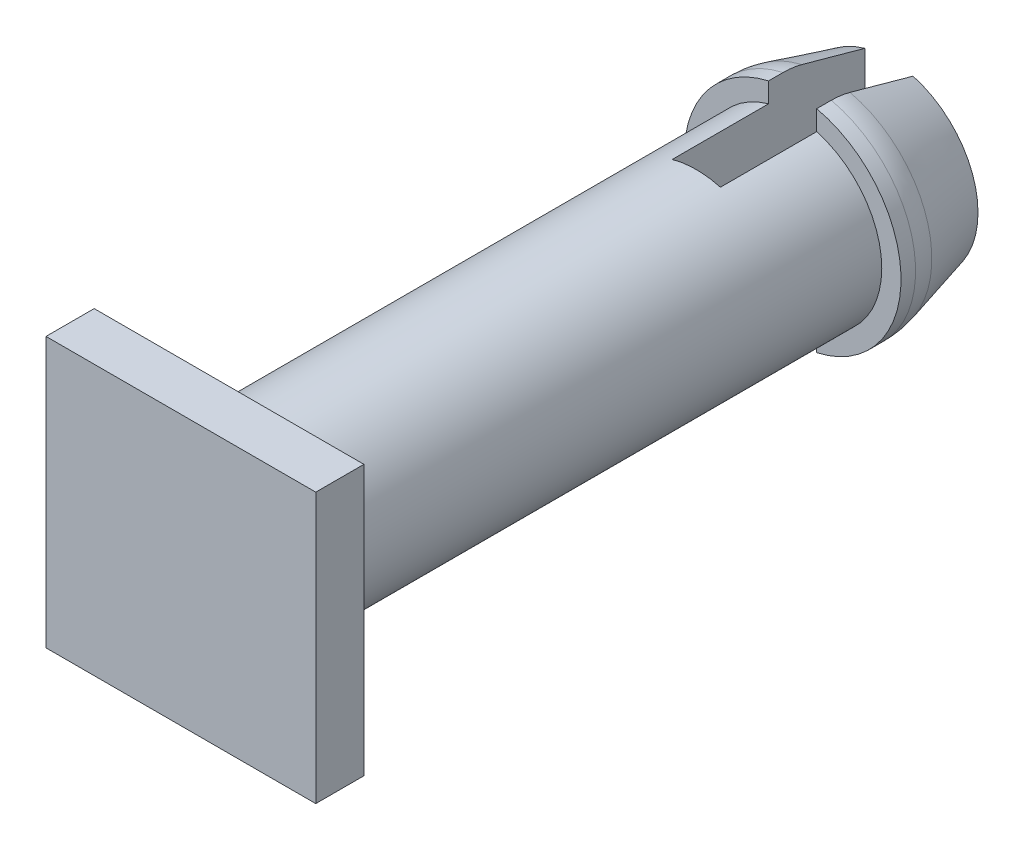
from build123d import *

# Parameters (mm, degrees)
SKETCH1_W           = 5.6
SKETCH1_H           = 5.6
BOSS_EXTRUDE1_DEPTH = 1
SKETCH1_3_R         = 1.85
BOSS_EXTRUDE2_DEPTH = 11.7
SKETCH2_R           = 0.6
CUT_EXTRUDE1_DEPTH  = 5
BOSS_EXTRUDE3_START = 2
SKETCH3_R           = 2.25
SKETCH3_R_2         = 0.6
BOSS_EXTRUDE3_DEPTH = 2
CHAMFER1_SIZE       = 1.5
CHAMFER1_SIZE2      = 0.401923789
SKETCH4_W           = 1
SKETCH4_H           = 5.286883196
CUT_EXTRUDE3_DEPTH  = 4
FILLET1_R           = 1.5


with BuildPart() as part:
    # Sketch1 → Boss-Extrude1 (new body)
    with BuildSketch(Plane.XY):
        Rectangle(SKETCH1_W, SKETCH1_H)
    extrude(amount=BOSS_EXTRUDE1_DEPTH)

    # Sketch1<3> → Boss-Extrude2 (add)
    with BuildSketch(Plane.XY):
        Circle(SKETCH1_3_R)
    extrude(amount=-BOSS_EXTRUDE2_DEPTH)

    # Sketch2 → Cut-Extrude1 (cut)
    with BuildSketch(Plane(origin=(0, 0, -11.7), x_dir=(-1, 0, 0), z_dir=(0, 0, -1))):
        Circle(SKETCH2_R)
    extrude(amount=-CUT_EXTRUDE1_DEPTH, mode=Mode.SUBTRACT)

    # Sketch3 → Boss-Extrude3 (add)
    with BuildSketch(Plane(origin=(0, 0, -11.7), x_dir=(-1, 0, 0), z_dir=(0, 0, -1)).offset(BOSS_EXTRUDE3_START)):
        Circle(SKETCH3_R)
        Circle(SKETCH3_R_2, mode=Mode.SUBTRACT)
    extrude(amount=-BOSS_EXTRUDE3_DEPTH)

    # Chamfer1
    chamfer1_edges = [part.edges().sort_by_distance(p)[0] for p in [
        (2.25, 0, -13.7),
    ]]
    chamfer1_side = [part.faces().sort_by_distance(p)[0] for p in [
        (2.25, 0, -12.7),
    ]]
    chamfer(chamfer1_edges, length=CHAMFER1_SIZE, length2=CHAMFER1_SIZE2, reference=chamfer1_side[0])

    # Sketch4 → Cut-Extrude3 (cut)
    with BuildSketch(Plane(origin=(0, 0, -13.7), x_dir=(-1, 0, 0), z_dir=(0, 0, -1))):
        Rectangle(SKETCH4_W, SKETCH4_H)
    extrude(amount=-CUT_EXTRUDE3_DEPTH, mode=Mode.SUBTRACT)

    # Fillet1
    fillet1_edges = [part.edges().sort_by_distance(p)[0] for p in [
        (2.25, 0, -12.2),
        (-2.25, 0, -12.2),
    ]]
    fillet(fillet1_edges, radius=FILLET1_R)


solid = part.part
